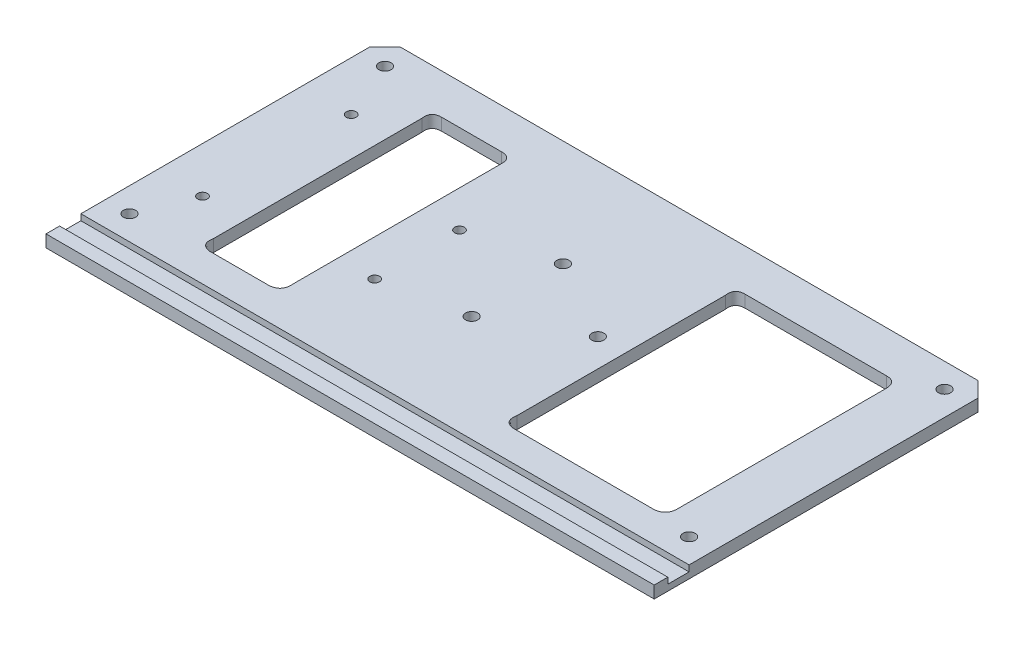
from build123d import *

# Parameters (mm, degrees)
ESQUISSE1_W             = 200
ESQUISSE1_H             = 100
ESQUISSE1_R             = 2
ESQUISSE1_R_2           = 1.6
BOSS_EXTRU_1_DEPTH      = 4
ENL_V_MAT_EXTRU_1_DEPTH = 10
BOSS_EXTRU_2_DEPTH      = 2
ESQUISSE4_W             = 200
ESQUISSE4_H             = 4.471345155
BOSS_EXTRU_3_DEPTH      = 2
CHANFREIN1_SIZE         = 5


with BuildPart() as part:
    # Esquisse1 → Boss.-Extru.1 (new body)
    with BuildSketch(Plane(origin=(0, 0, 0), x_dir=(1, 0, 0), z_dir=(0, 1, 0))):
        Rectangle(ESQUISSE1_W, ESQUISSE1_H)
        with Locations(Location((-92, 42, 0), (0, 0, 270))):
            Circle(ESQUISSE1_R, mode=Mode.SUBTRACT)
        with Locations(Location((92, 42, 0), (0, 0, 90))):
            Circle(ESQUISSE1_R, mode=Mode.SUBTRACT)
        with Locations(Location((92, -42, 0), (0, 0, 270))):
            Circle(ESQUISSE1_R, mode=Mode.SUBTRACT)
        with Locations(Location((-92, -42, 0), (0, 0, 90))):
            Circle(ESQUISSE1_R, mode=Mode.SUBTRACT)
        with Locations(Location((-6.5, -15, 0), (0, 0, 270))):
            Circle(ESQUISSE1_R, mode=Mode.SUBTRACT)
        with Locations(Location((20, 0, 0), (0, 0, 270))):
            Circle(ESQUISSE1_R, mode=Mode.SUBTRACT)
        with Locations(Location((-6.5, 15, 0), (0, 0, 90))):
            Circle(ESQUISSE1_R, mode=Mode.SUBTRACT)
        with Locations(Location((-33.1, -20.3, 0), (0, 0, 270))):
            Circle(ESQUISSE1_R_2, mode=Mode.SUBTRACT)
        with Locations(Location((-33.1, 7.6, 0), (0, 0, 270))):
            Circle(ESQUISSE1_R_2, mode=Mode.SUBTRACT)
        with Locations(Location((-85, -25, 0), (0, 0, 270))):
            Circle(ESQUISSE1_R_2, mode=Mode.SUBTRACT)
        with Locations(Location((-83.8, 22.7, 0), (0, 0, 270))):
            Circle(ESQUISSE1_R_2, mode=Mode.SUBTRACT)
    extrude(amount=BOSS_EXTRU_1_DEPTH)

    # Esquisse2 → Enlèv. mat.-Extru.1 (cut)
    with BuildSketch(Plane(origin=(0, 4, 0), x_dir=(1, 0, 0), z_dir=(0, 1, 0))):
        with BuildLine():
            Line((-71.12395108, 33.267340446), (-71.12395108, -35.262942493))
            add(Edge.make_bspline(
                [(-71.12395108, -35.262942493), (-71.80811413, -39.025609189), (-68.179899303, -39.50320708)],
                knots=[0, 0, 0, 1, 1, 1], degree=2))
            Line((-68.179899303, -39.50320708), (-48.41260505, -39.50320708))
            add(Edge.make_bspline(
                [(-45.119156215, -35.262942493), (-44.797316754, -39.038148597), (-48.41260505, -39.50320708)],
                knots=[0, 0, 0, 1, 1, 1], degree=2))
            Line((-45.119156215, -35.262942493), (-45.119156215, 33.267340446))
            add(Edge.make_bspline(
                [(-48.41260505, 36.799015417), (-44.987803153, 36.784833779), (-45.119156215, 33.267340446)],
                knots=[0, 0, 0, 1, 1, 1], degree=2))
            Line((-48.41260505, 36.799015417), (-68.179899303, 36.799015417))
            add(Edge.make_bspline(
                [(-68.179899303, 36.799015417), (-71.625685069, 36.783683635), (-71.12395108, 33.267340446)],
                knots=[0, 0, 0, 1, 1, 1], degree=2))
        make_face()
        with BuildLine():
            Line((29.185631994, 32.76936094), (29.185631994, -35.760921998))
            add(Edge.make_bspline(
                [(29.185631994, -35.760921998), (28.501468944, -39.523588695), (32.129683771, -40.001186586)],
                knots=[0, 0, 0, 1, 1, 1], degree=2))
            Line((32.129683771, -40.001186586), (78.655845139, -40.001186586))
            add(Edge.make_bspline(
                [(82.138089103, -35.760921998), (82.221370803, -39.504216764), (78.655845139, -40.001186586)],
                knots=[0, 0, 0, 1, 1, 1], degree=2))
            Line((82.138089103, -35.760921998), (82.138089103, 32.76936094))
            add(Edge.make_bspline(
                [(78.655845139, 36.301035912), (82.034782777, 36.251456851), (82.138089103, 32.76936094)],
                knots=[0, 0, 0, 1, 1, 1], degree=2))
            Line((78.655845139, 36.301035912), (32.129683771, 36.301035912))
            add(Edge.make_bspline(
                [(32.129683771, 36.301035912), (28.683898005, 36.28570413), (29.185631994, 32.76936094)],
                knots=[0, 0, 0, 1, 1, 1], degree=2))
        make_face()
    extrude(amount=-ENL_V_MAT_EXTRU_1_DEPTH, mode=Mode.SUBTRACT)

    # Esquisse3 → Boss.-Extru.2 (add)
    with BuildSketch(Plane.XZ):
        Polygon((-100, 50), (-100, 61.471345155), (0, 61.471345155), (100, 61.471345155), (100, 50), align=None)
    extrude(amount=-BOSS_EXTRU_2_DEPTH)

    # Esquisse4 → Boss.-Extru.3 (add)
    with BuildSketch(Plane(origin=(0, 2, 0), x_dir=(1, 0, 0), z_dir=(0, 1, 0))):
        with Locations((0, -59.235672577)):
            Rectangle(ESQUISSE4_W, ESQUISSE4_H)
    extrude(amount=BOSS_EXTRU_3_DEPTH)

    # Chanfrein1
    chanfrein1_edges = [part.edges().sort_by_distance(p)[0] for p in [
        (-100, 2, -50),
        (100, 2, -50),
    ]]
    chamfer(chanfrein1_edges, length=CHANFREIN1_SIZE)


solid = part.part
